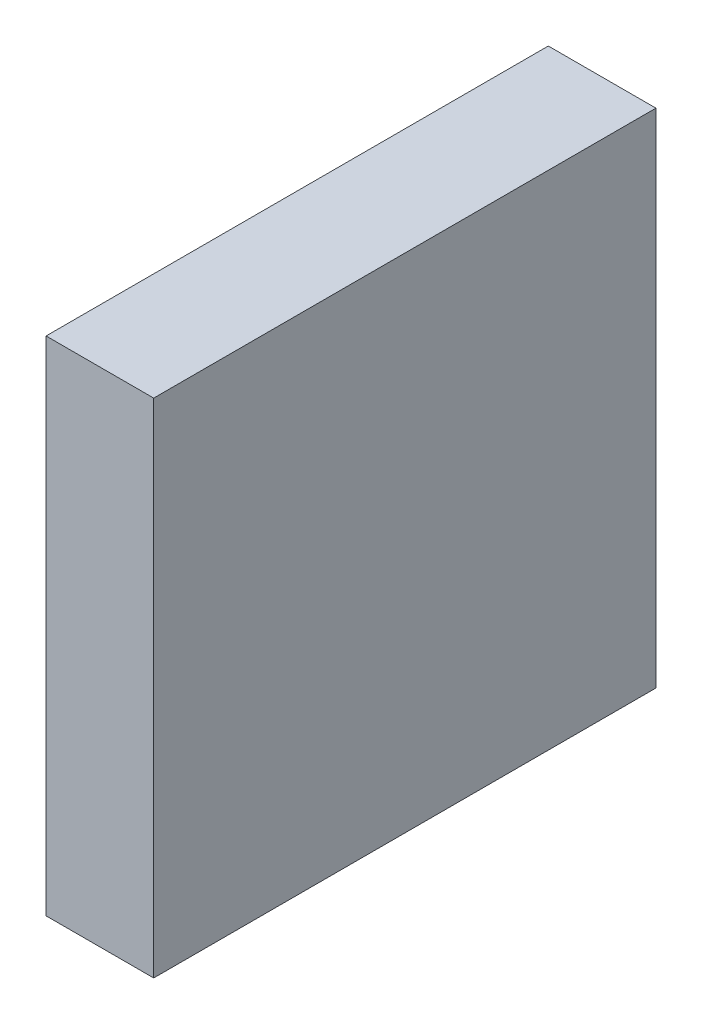
from build123d import *

# Parameters (mm, degrees)
TOPPING_EVAP_FAN_1_1_START = -330
SKETCH1_W                  = 30
SKETCH1_H                  = 140
TOPPING_EVAP_FAN_1_1_DEPTH = 140


with BuildPart() as part:
    # Sketch1 → TOPPING_evap_fan_1_1 (new body)
    with BuildSketch(Plane.XY.offset(TOPPING_EVAP_FAN_1_1_START)):
        with Locations((187.5, 550)):
            Rectangle(SKETCH1_W, SKETCH1_H)
    extrude(amount=-TOPPING_EVAP_FAN_1_1_DEPTH)


solid = part.part
